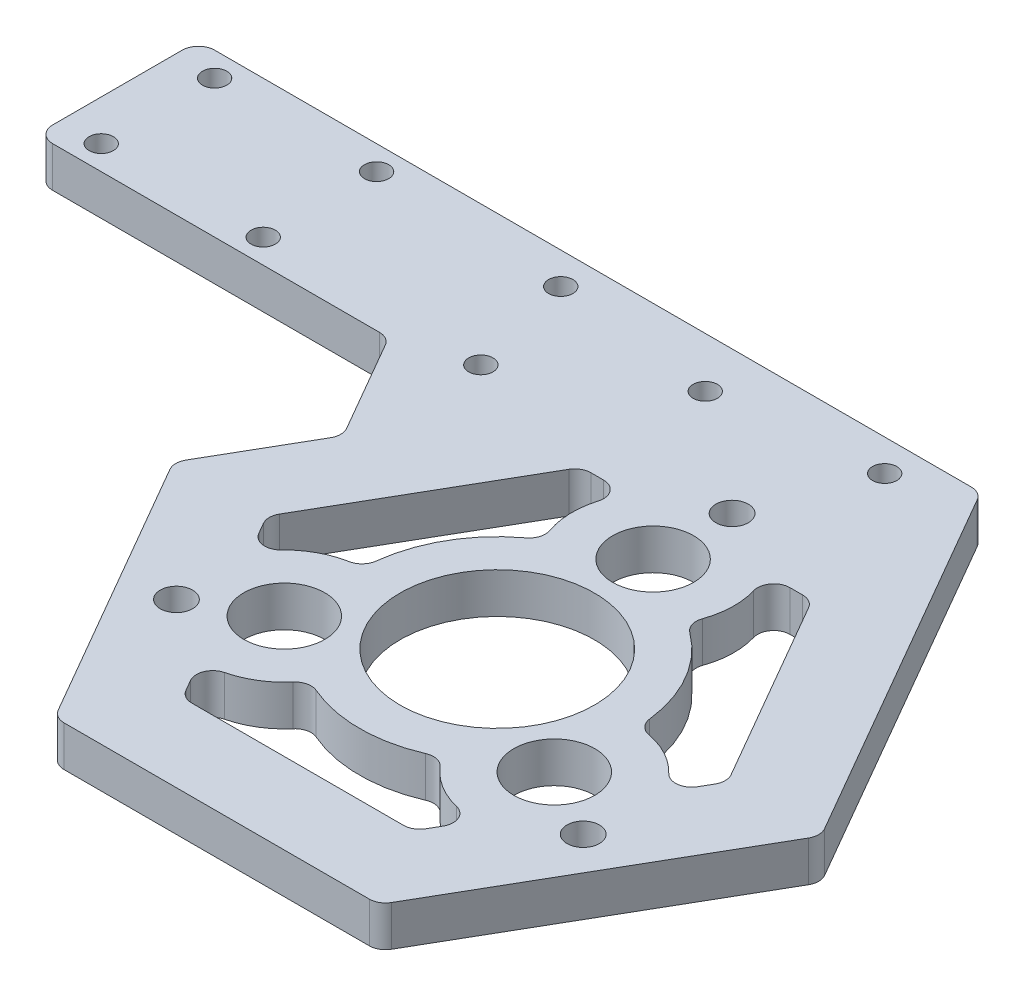
from build123d import *

# Parameters (mm, degrees)
EXTRUDE_1_DEPTH     = 5
SKETCH_2_R          = 2
SKETCH_2_R_2        = 5
SKETCH_2_R_3        = 12
CUT_EXTRUDE_1_DEPTH = 96.753903315
SKETCH_3_R          = 1.5
CUT_EXTRUDE_2_DEPTH = 96.753903315
CUT_EXTRUDE_4_DEPTH = 96.753903315
FILLET_1_R          = 2
FILLET_2_R          = 2
SKETCH_5_R          = 1.5
CUT_EXTRUDE_5_DEPTH = 10


with BuildPart() as part:
    # 草图1 → 凸台-拉伸1 (new body)
    with BuildSketch(Plane(origin=(0, 0, 0), x_dir=(1, 0, 0), z_dir=(0, 1, 0))):
        Polygon((20, -34.641016151), (40, 0), (20, 34.641016151), (13.095477456, 46.6), (-83.5, 46.6), (-83.5, 26.6), (-40, 26.6), (-32.32124142, 13.3), (-40, 0), (-20, -34.641016151), align=None)
    extrude(amount=EXTRUDE_1_DEPTH)

    # 草图2 → 切除-拉伸1 (cut, through all)
    with BuildSketch(Plane(origin=(0, 5, 0), x_dir=(1, 0, 0), z_dir=(0, 1, 0))):
        with Locations(Location((0, 29, 0), (0, 0, 270))):
            Circle(SKETCH_2_R)
        with Locations(Location((25.11473671, -14.5, 0), (0, 0, 270))):
            Circle(SKETCH_2_R)
        with Locations(Location((-25.11473671, -14.5, 0), (0, 0, 270))):
            Circle(SKETCH_2_R)
        with Locations(Location((0, 19.25, 0), (0, 0, 270))):
            Circle(SKETCH_2_R_2)
        with Locations(Location((0, 0, 0), (0, 0, 270))):
            Circle(SKETCH_2_R_3)
        with Locations(Location((16.670989023, -9.625, 0), (0, 0, 270))):
            Circle(SKETCH_2_R_2)
        with Locations(Location((-16.670989023, -9.625, 0), (0, 0, 270))):
            Circle(SKETCH_2_R_2)
    extrude(amount=-CUT_EXTRUDE_1_DEPTH, mode=Mode.SUBTRACT)

    # 草图3 → 切除-拉伸2 (cut, through all)
    with BuildSketch(Plane.XZ):
        with Locations(Location((-78.5, -29.6, 0), (0, 0, 270))):
            Circle(SKETCH_3_R)
        with Locations(Location((-58.5, -29.6, 0), (0, 0, 270))):
            Circle(SKETCH_3_R)
        with Locations(Location((-58.5, -43.6, 0), (0, 0, 90))):
            Circle(SKETCH_3_R)
        with Locations(Location((-78.5, -43.6, 0), (0, 0, 90))):
            Circle(SKETCH_3_R)
    extrude(amount=-CUT_EXTRUDE_2_DEPTH, mode=Mode.SUBTRACT)

    # 草图4 → 切除-拉伸4 (cut, through all)
    with BuildSketch(Plane.XZ):
        with BuildLine():
            ThreePointArc((-16.995979196, -0.369717674), (-22.006018762, 1.167018108), (-25.550949616, 5.026489386))
            Line((-25.550949616, 5.026489386), (-28.452994616, 0))
            Line((-28.452994616, 0), (-14.226497308, -24.641016151))
            Line((-14.226497308, -24.641016151), (-8.422407308, -24.641016151))
            ThreePointArc((-8.422407308, -24.641016151), (-9.992342053, -19.641280338), (-8.818174496, -14.534090909))
            ThreePointArc((-8.818174496, -14.534090909), (-14.722431864, -8.5), (-16.995979196, -0.369717674))
        make_face()
        with BuildLine():
            Line((28.452994616, 0), (25.550949616, 5.026489386))
            ThreePointArc((25.550949616, 5.026489386), (22.006018762, 1.167018108), (16.995979196, -0.369717674))
            ThreePointArc((16.995979196, -0.369717674), (14.722431864, -8.5), (8.818174496, -14.534090909))
            ThreePointArc((8.818174496, -14.534090909), (9.700044973, -16.819130296), (10, -19.25))
            ThreePointArc((10, -19.25), (9.597501578, -22.058551844), (8.422407308, -24.641016151))
            Line((8.422407308, -24.641016151), (14.226497308, -24.641016151))
            Line((14.226497308, -24.641016151), (28.452994616, 0))
        make_face()
        with BuildLine():
            Line((17.128542308, 19.614526765), (14.226497308, 24.641016151))
            Line((14.226497308, 24.641016151), (-14.226497308, 24.641016151))
            Line((-14.226497308, 24.641016151), (-17.128542308, 19.614526765))
            ThreePointArc((-17.128542308, 19.614526765), (-12.013676709, 18.47426223), (-8.1778047, 14.903808583))
            ThreePointArc((-8.1778047, 14.903808583), (0, 17), (8.1778047, 14.903808583))
            ThreePointArc((8.1778047, 14.903808583), (12.013676709, 18.47426223), (17.128542308, 19.614526765))
        make_face()
    extrude(amount=-CUT_EXTRUDE_4_DEPTH, mode=Mode.SUBTRACT)

    # 圆角1
    fillet_1_edges = [part.edges().sort_by_distance(p)[0] for p in [
        (-8.1778047, 2.5, 14.903808583),
        (-17.128542308, 2.5, 19.614526765),
        (-14.226497308, 2.5, 24.641016151),
        (14.226497308, 2.5, 24.641016151),
        (17.128542308, 2.5, 19.614526765),
        (8.1778047, 2.5, 14.903808583),
        (16.995979196, 2.5, -0.369717674),
        (25.550949616, 2.5, 5.026489386),
        (28.452994616, 2.5, 0),
        (14.226497308, 2.5, -24.641016151),
        (8.422407308, 2.5, -24.641016151),
        (8.818174496, 2.5, -14.534090909),
        (-25.550949616, 2.5, 5.026489386),
        (-16.995979196, 2.5, -0.369717674),
        (-8.818174496, 2.5, -14.534090909),
        (-8.422407308, 2.5, -24.641016151),
        (-14.226497308, 2.5, -24.641016151),
        (-28.452994616, 2.5, 0),
    ]]
    fillet(fillet_1_edges, radius=FILLET_1_R)

    # 圆角2
    fillet_2_edges = [part.edges().sort_by_distance(p)[0] for p in [
        (-20, 2.5, 34.641016151),
        (-40, 2.5, 0),
        (-32.32124142, 2.5, -13.3),
        (-40, 2.5, -26.6),
        (-83.5, 2.5, -26.6),
        (-83.5, 2.5, -46.6),
        (13.095477456, 2.5, -46.6),
        (40, 2.5, 0),
        (20, 2.5, 34.641016151),
    ]]
    fillet(fillet_2_edges, radius=FILLET_2_R)

    # 草图5 → 切除-拉伸5 (cut)
    with BuildSketch(Plane.XZ):
        with Locations(Location((-31.401807915, -29.375609946, 0), (0, 0, 270))):
            Circle(SKETCH_5_R)
        with Locations(Location((-14.716714858, -40.403196703, 0), (0, 0, 270))):
            Circle(SKETCH_5_R)
        with Locations(Location((5.152091527, -42.690232523, 0), (0, 0, 270))):
            Circle(SKETCH_5_R)
        with Locations(Location((-34.847908473, -42.690232523, 0), (0, 0, 270))):
            Circle(SKETCH_5_R)
    extrude(amount=-CUT_EXTRUDE_5_DEPTH, mode=Mode.SUBTRACT)


solid = part.part
